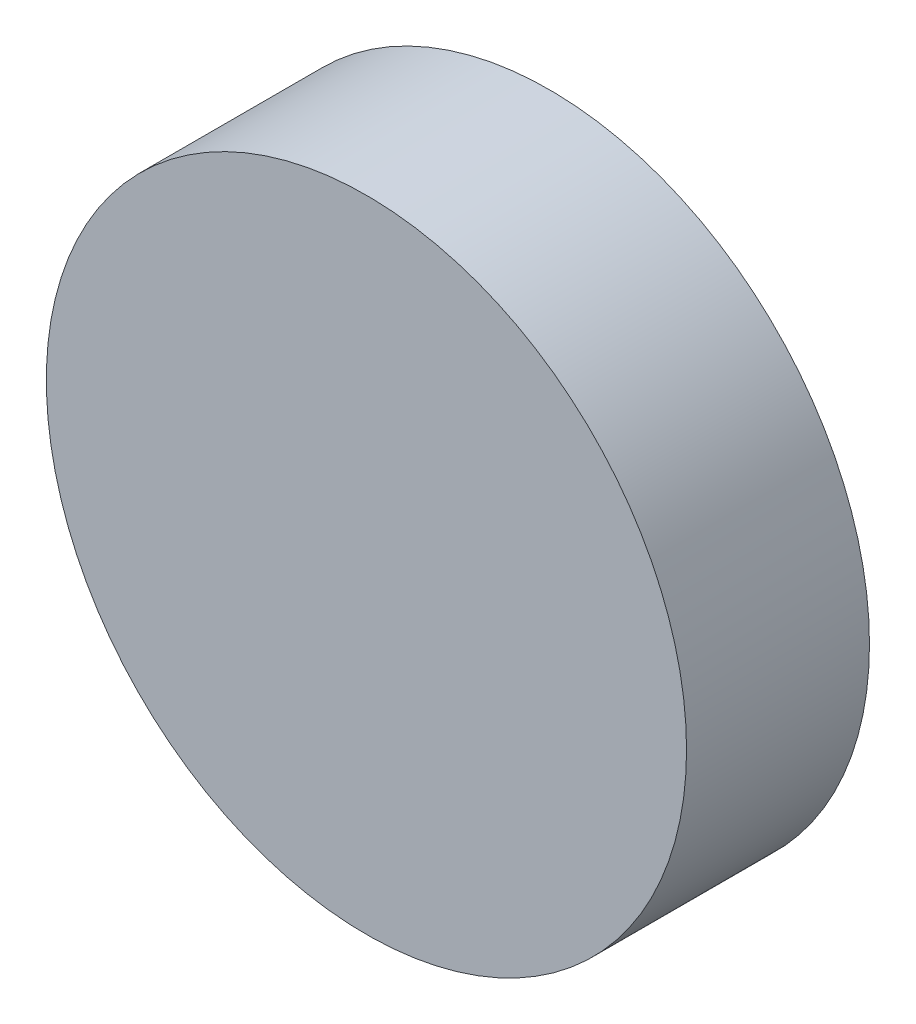
from build123d import *

# Parameters (mm, degrees)
ESQUISSE1_R        = 35
BOSS_EXTRU_1_DEPTH = 20


with BuildPart() as part:
    # Esquisse1 → Boss.-Extru.1 (new body)
    with BuildSketch(Plane.XY):
        Circle(ESQUISSE1_R)
    extrude(amount=BOSS_EXTRU_1_DEPTH)


solid = part.part
